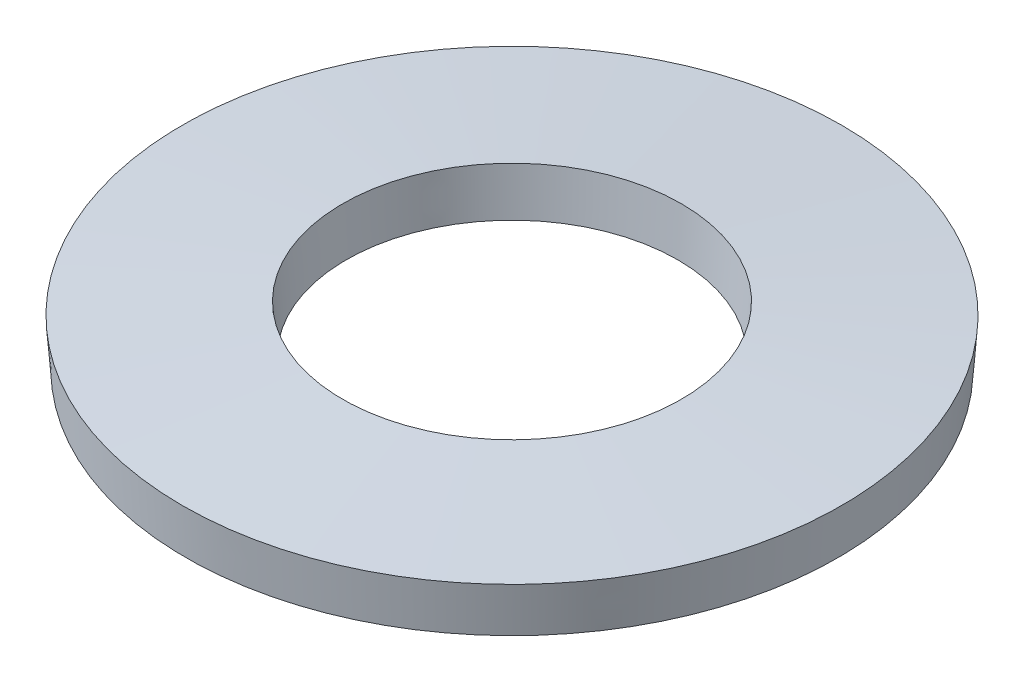
from build123d import *


with BuildPart() as part:
    # Sketch1 → Revolve1 (revolve)
    with BuildSketch(Plane.XY, mode=Mode.PRIVATE) as revolve1_sk:
        Polygon((18.847026854, 0), (9.5885, 0.693389908), (9.791473146, 3.4036), (19.05, 2.710210092), align=None)
    revolve(revolve1_sk.sketch.rotate(Axis((0, 0, 0), (0, 1, 0)), 90), axis=Axis((0, 0, 0), (0, 1, 0)))


solid = part.part
